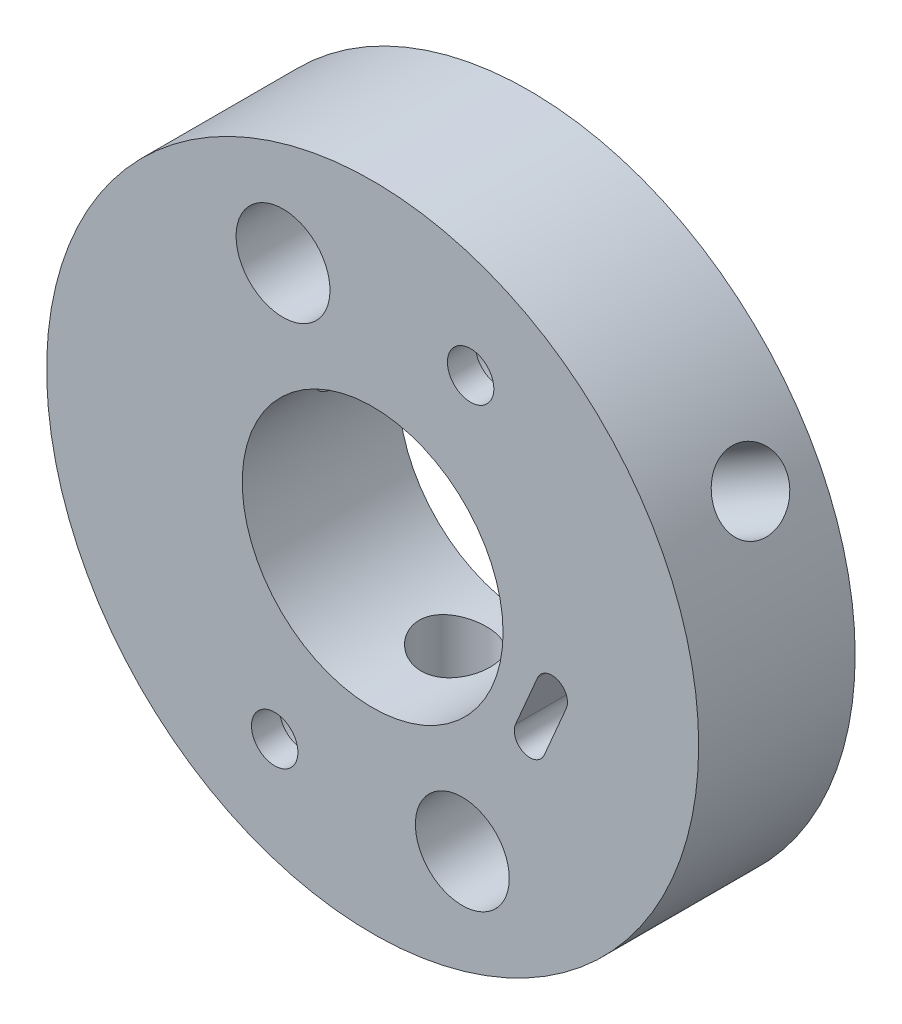
from build123d import *

# Parameters (mm, degrees)
SKETCH1_R                                      = 15.875
BOSS_EXTRUDE1_DEPTH                            = 7.62
SKETCH2_R                                      = 6.35
CUT_EXTRUDE1_DEPTH                             = 24.708556472
CIRPATTERN1_COUNT                              = 3
CBORE_FOR_2_BUTTON_HEAD_CAP_SCREW1_D           = 2.2606
CBORE_FOR_2_BUTTON_HEAD_CAP_SCREW1_CBORE_D     = 5.15874
CBORE_FOR_2_BUTTON_HEAD_CAP_SCREW1_CBORE_DEPTH = 6.2484
CIRPATTERN2_COUNT                              = 2
SKETCH42_R                                     = 2.286
CUT_EXTRUDE2_DEPTH                             = 7.62
CIRPATTERN3_COUNT                              = 2
CUT_EXTRUDE3_DEPTH                             = 24.70855664


with BuildPart() as part:
    # Sketch1 → Boss-Extrude1 (new body)
    with BuildSketch(Plane.XY):
        with Locations(Location((0, 0, 0), (0, 0, 180))):
            Circle(SKETCH1_R)
    extrude(amount=BOSS_EXTRUDE1_DEPTH)

    # Sketch2 → Cut-Extrude1 (cut, through all)
    with BuildSketch(Plane.XY.offset(7.62)):
        Circle(SKETCH2_R)
    extrude(amount=-CUT_EXTRUDE1_DEPTH, mode=Mode.SUBTRACT)

    # Sketch36 → Tap Drill for #8-32 Tap1 (revolve, cut)
    with BuildSketch(Plane(origin=(-0.450397279, -15.875, 3.175), x_dir=(0, 0, -1), z_dir=(1, 0, 0))):
        Polygon((0, 0), (0, 20.499292883), (1.7272, 19.05), (1.7272, 0), align=None)
    tap_drill_for_8_32_tap1 = revolve(axis=Axis((-0.450397279, -22.225, 3.175), (0, 1, 0)), mode=Mode.SUBTRACT)

    # CirPattern1: Tap Drill for #8-32 Tap1 ×3 about axis
    cirpattern1_axis = Axis((0, 0, 7.62), (0, 0, -1))
    for i in range(1, CIRPATTERN1_COUNT):
        add(tap_drill_for_8_32_tap1.rotate(cirpattern1_axis, i * 360 / CIRPATTERN1_COUNT), mode=Mode.SUBTRACT)

    # CBORE for #2 Button Head Cap Screw1 (through all)
    with Locations(Plane(origin=(0, 0, 0), x_dir=(-1, 0, 0), z_dir=(0, 0, -1))):
        with Locations((4.769587089, -10.050926029)):
            cbore_for_2_button_head_cap_screw1 = CounterBoreHole(CBORE_FOR_2_BUTTON_HEAD_CAP_SCREW1_D / 2, CBORE_FOR_2_BUTTON_HEAD_CAP_SCREW1_CBORE_D / 2, CBORE_FOR_2_BUTTON_HEAD_CAP_SCREW1_CBORE_DEPTH)

    # CirPattern2: CBORE for #2 Button Head Cap Screw1 ×2 about axis
    cirpattern2_axis = Axis((0, 0, 0), (0, 0, 1))
    for i in range(1, CIRPATTERN2_COUNT):
        add(cbore_for_2_button_head_cap_screw1.rotate(cirpattern2_axis, i * 360 / CIRPATTERN2_COUNT), mode=Mode.SUBTRACT)

    # Sketch42 → Cut-Extrude2 (cut)
    with BuildSketch(Plane(origin=(0, 0, 0), x_dir=(-1, 0, 0), z_dir=(0, 0, -1))):
        with Locations((4.365368762, 10.219159056)):
            Circle(SKETCH42_R)
    cut_extrude2 = extrude(amount=-CUT_EXTRUDE2_DEPTH, mode=Mode.SUBTRACT)

    # CirPattern3: Cut-Extrude2 ×2 about axis
    cirpattern3_axis = Axis((0, 0, 0), (0, 0, 1))
    for i in range(1, CIRPATTERN3_COUNT):
        add(cut_extrude2.rotate(cirpattern3_axis, i * 360 / CIRPATTERN3_COUNT), mode=Mode.SUBTRACT)

    # Sketch43 → Cut-Extrude3 (cut, through all)
    with BuildSketch(Plane(origin=(0, 0, 0), x_dir=(-1, 0, 0), z_dir=(0, 0, -1))):
        with BuildLine():
            Line((-8.025711128, -1.073137194), (-6.956985206, -3.563699487))
            ThreePointArc((-6.956985206, -3.563699487), (-7.355887027, -4.562271884), (-8.354459424, -4.163370063))
            Line((-8.354459424, -4.163370063), (-9.423185347, -1.67280777))
            ThreePointArc((-9.423185347, -1.67280777), (-9.024283525, -0.674235373), (-8.025711128, -1.073137194))
        make_face()
    extrude(amount=-CUT_EXTRUDE3_DEPTH, mode=Mode.SUBTRACT)


solid = part.part
